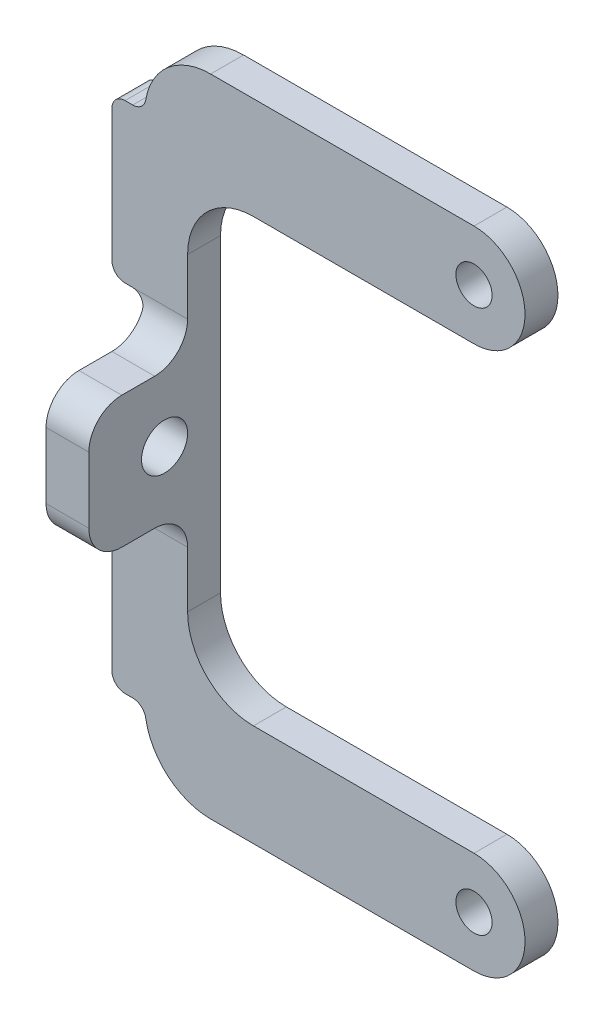
from build123d import *

# Parameters (mm, degrees)
SKETCH1_R           = 7.750000000000002
SKETCH1_R_2         = 2.7500000000000013
SKETCH1_R_3         = 7.749999999999997
SKETCH1_R_4         = 2.7499999999999973
BOSS_EXTRUDE1_DEPTH = 5
BOSS_EXTRUDE2_DEPTH = 5
BOSS_EXTRUDE3_DEPTH = 10
BOSS_EXTRUDE4_DEPTH = 5
FILLET1_R           = 5
SKETCH6_R           = 3.5
CUT_EXTRUDE1_DEPTH  = 5
CUT_EXTRUDE2_DEPTH  = 3
BOSS_EXTRUDE5_DEPTH = 3
FILLET2_R           = 10
BOSS_EXTRUDE6_DEPTH = 5
FILLET3_R           = 2


with BuildPart() as part:
    # Sketch1 → Boss-Extrude1 (new body)
    # profile 1 of 4: a face of its own
    with BuildSketch(Plane.XY):
        with BuildLine():
            ThreePointArc((-10.000000000000002, 33.49999999999998), (-17.75, 41.24999999999998), (-10, 48.99999999999998))
            Line((-10, 48.99999999999998), (-60.00000000000001, 48.99999999999998))
            Line((-60.00000000000001, 48.99999999999998), (-60, 33.49999999999997))
            Line((-60, 33.49999999999997), (-10, 33.49999999999998))
        make_face()
    # profile 2 of 4: a face of its own
    with BuildSketch(Plane.XY):
        with Locations((-10, 41.24999999999998)):
            Circle(SKETCH1_R)
        with Locations((-10, 41.24999999999998)):
            Circle(SKETCH1_R_2, mode=Mode.SUBTRACT)
    # profile 3 of 4: a face of its own
    with BuildSketch(Plane.XY):
        with Locations((-9.999999999999927, -41.24999999999999)):
            Circle(SKETCH1_R_3)
        with Locations((-9.999999999999927, -41.24999999999999)):
            Circle(SKETCH1_R_4, mode=Mode.SUBTRACT)
    # profile 4 of 4: a face of its own
    with BuildSketch(Plane.XY):
        with BuildLine():
            Line((-59.99999999999993, -48.999999999999986), (-9.999999999999927, -48.99999999999999))
            ThreePointArc((-9.999999999999929, -48.99999999999999), (-17.749999999999925, -41.24999999999999), (-9.999999999999927, -33.49999999999999))
            Line((-9.999999999999927, -33.49999999999999), (-59.99999999999993, -33.5))
            Line((-59.99999999999993, -33.5), (-59.99999999999993, -48.999999999999986))
        make_face()
    extrude(amount=BOSS_EXTRUDE1_DEPTH)

    # Sketch2 → Boss-Extrude2 (add)
    with BuildSketch(Plane.XY.offset(5)):
        Polygon((-53.500000000000014, -7.500000000000029), (-53.500000000000014, 7.499999999999971), (-53.500000000000014, 33.49999999999998), (-60, 33.49999999999997), (-59.99999999999993, -33.5), (-53.500000000000014, -33.49999999999999), align=None)
    extrude(amount=-BOSS_EXTRUDE2_DEPTH)

    # Sketch3 → Boss-Extrude3 (add)
    with BuildSketch(Plane.XY.offset(5)):
        Polygon((-59.99999999999997, -6.94e-15), (-53.500000000000014, 0), (-53.500000000000014, 10), (-59.99999999999997, 9.999999999999986), align=None)
        Polygon((-53.500000000000014, -10), (-53.500000000000014, 0), (-59.99999999999997, -6.94e-15), (-59.99999999999997, -10.000000000000014), align=None)
    extrude(amount=BOSS_EXTRUDE3_DEPTH)

    # Sketch4 → Boss-Extrude4 (add)
    with BuildSketch(Plane.XY.offset(15)):
        Polygon((-53.500000000000014, -10.000000000000007), (-53.500000000000014, 9.999999999999993), (-59.99999999999999, 9.999999999999986), (-59.99999999999998, -10.000000000000014), align=None)
    extrude(amount=BOSS_EXTRUDE4_DEPTH)

    # Fillet1
    fillet1_edges = [part.edges().sort_by_distance(p)[0] for p in [
        (-56.74999999999999, 9.999999999999993, 5),
        (-56.74999999999999, -10.000000000000007, 5),
        (-56.75, -10.00000000000001, 20),
        (-56.75, 9.99999999999999, 20),
    ]]
    fillet(fillet1_edges, radius=FILLET1_R)

    # Sketch6 → Cut-Extrude1 (cut)
    with BuildSketch(Plane(origin=(-53.500000000000014, 0, 0), x_dir=(0, 0, -1), z_dir=(1, -1e-16, 0))):
        with Locations(Location((-8.500000000000007, -3.49e-15, 0), (0, 0, 90))):
            Circle(SKETCH6_R)
    extrude(amount=-CUT_EXTRUDE1_DEPTH, mode=Mode.SUBTRACT)

    # Sketch7 → Cut-Extrude2 (cut)
    with BuildSketch(Plane.ZY.offset(59.999999999999986)):
        Polygon((8.500000000000009, -8.99999999999997), (8.500000000000007, 2.958e-14), (8.500000000000007, 9.000000000000028), (7.000000000000008, 9.000000000000028), (7.000000000000008, 2.958e-14), (7.000000000000008, -8.99999999999997), align=None)
        Polygon((8.500000000000007, 9.000000000000028), (8.500000000000007, 2.958e-14), (8.500000000000009, -8.99999999999997), (10.000000000000007, -8.99999999999997), (10.000000000000007, 2.958e-14), (10.000000000000007, 9.000000000000028), align=None)
        Polygon((8.500000000000007, 9.000000000000028), (8.500000000000007, 2.958e-14), (8.500000000000009, -8.99999999999997), (10.000000000000007, -8.99999999999997), (10.000000000000007, 2.958e-14), (10.000000000000007, 9.000000000000028), align=None)
        Polygon((8.500000000000009, -8.99999999999997), (8.500000000000007, 2.958e-14), (8.500000000000007, 9.000000000000028), (7.000000000000008, 9.000000000000028), (7.000000000000008, 2.958e-14), (7.000000000000008, -8.99999999999997), align=None)
    extrude(amount=-CUT_EXTRUDE2_DEPTH, mode=Mode.SUBTRACT)

    # Sketch9 → Boss-Extrude5 (add)
    with BuildSketch(Plane.ZY.offset(56.99999999999998)):
        with BuildLine():
            Line((7.000000000000008, -3.1622776601683573), (7.000000000000008, -8.999999999999968))
            Line((7.000000000000008, -8.999999999999968), (10.000000000000007, -8.999999999999968))
            Line((10.000000000000007, -8.999999999999968), (10.000000000000007, -3.1622776601683573))
            ThreePointArc((10.000000000000007, -3.1622776601683573), (8.500000000000007, -3.4999999999999774), (7.000000000000008, -3.1622776601683573))
        make_face()
    extrude(amount=BOSS_EXTRUDE5_DEPTH)

    # Fillet2
    fillet2_edges = [part.edges().sort_by_distance(p)[0] for p in [
        (-60.00000000000001, 48.99999999999998, 2.5),
        (-53.500000000000014, 33.49999999999998, 2.5),
        (-53.500000000000014, -33.49999999999999, 2.5),
        (-59.99999999999993, -48.999999999999986, 2.5),
    ]]
    fillet(fillet2_edges, radius=FILLET2_R)

    # Sketch10 → Boss-Extrude6 (add)
    with BuildSketch(Plane.ZY.offset(59.999999999999986)):
        Polygon((5, -14.999999999999988), (0, -14.999999999999986), (0, -38.99999999999997), (5, -38.999999999999964), align=None)
        Polygon((0, 15.000000000000014), (5.000000000000004, 15.000000000000012), (5, 39), (0, 39), align=None)
    extrude(amount=BOSS_EXTRUDE6_DEPTH)

    # Fillet3
    fillet3_edges = [part.edges().sort_by_distance(p)[0] for p in [
        (-59.99999999999993, 38.99999999999997, 2.5),
        (-59.99999999999993, -38.999999999999986, 2.5),
        (-59.99999999999998, -15.000000000000012, 2.5),
        (-64.99999999999999, -15.000000000000014, 2.5),
        (-64.99999999999997, -38.99999999999999, 2.5),
        (-64.99999999999999, 14.999999999999986, 2.500000000000002),
        (-65, 38.99999999999997, 2.5),
        (-59.99999999999999, 14.999999999999988, 2.500000000000002),
    ]]
    fillet(fillet3_edges, radius=FILLET3_R)


solid = part.part
